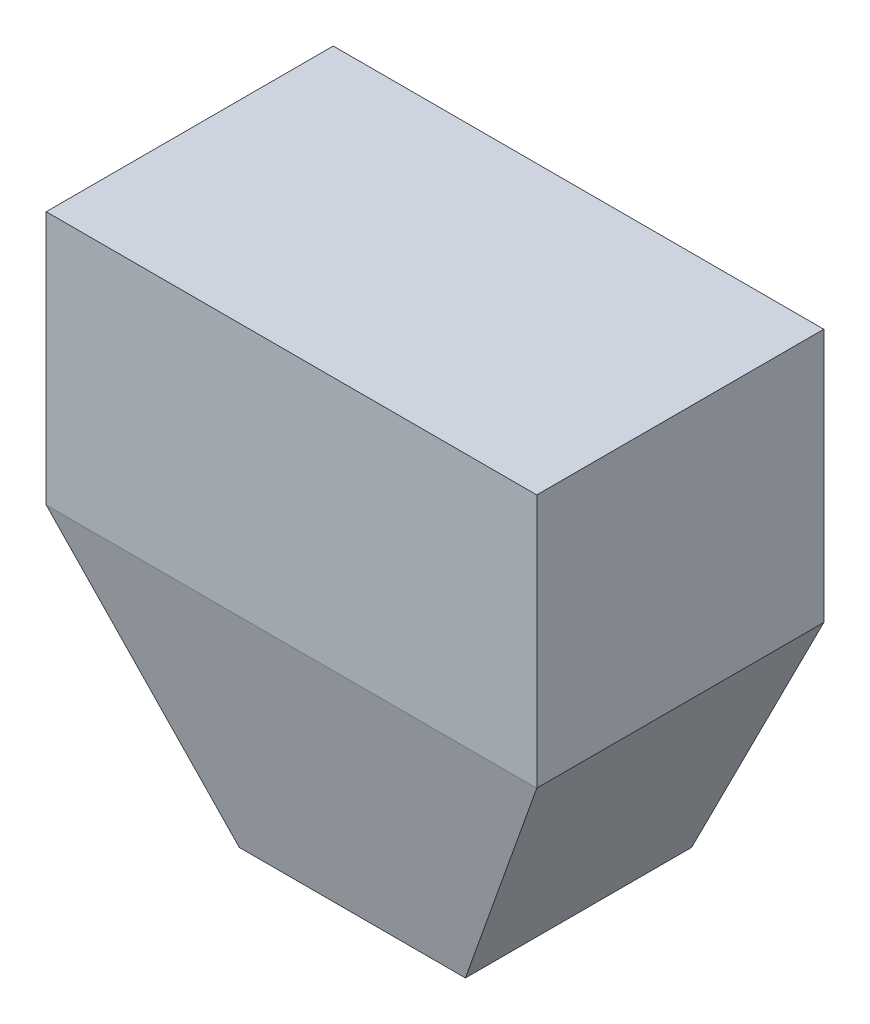
from build123d import *

# Parameters (mm, degrees)
SKETCH1_W           = 28.2
SKETCH1_H           = 29.2
BOSS_EXTRUDE1_DEPTH = 3
BOSS_EXTRUDE2_START = -3
SKETCH1_3_W         = 28.2
SKETCH1_3_H         = 29.2
BOSS_EXTRUDE2_DEPTH = 30
SKETCH3_3_W         = 20.4
SKETCH3_3_H         = 20.4
CUT_EXTRUDE1_DEPTH  = 30
CUT_EXTRUDE2_REACH  = 72.378
SKETCH4_R           = 2


with BuildPart() as part:
    # Sketch1 → Boss-Extrude1 (new body)
    with BuildSketch(Plane.XY):
        with Locations((-1, 0)):
            Rectangle(SKETCH1_W, SKETCH1_H)
    boss_extrude1 = extrude(amount=-BOSS_EXTRUDE1_DEPTH)

    # Sketch1<3> → Boss-Extrude2 (add)
    with BuildSketch(Plane.XY.offset(BOSS_EXTRUDE2_START)):
        with Locations((-1, 0)):
            Rectangle(SKETCH1_3_W, SKETCH1_3_H)
        with BuildLine():
            Line((-10.1, 2.9), (-10.1, 9))
            ThreePointArc((-10.1, 9), (-9.777817459, 9.777817459), (-9, 10.1))
            Line((-9, 10.1), (-2.9, 10.1))
            Line((-2.9, 10.1), (-2.9, 7.9))
            Line((-2.9, 7.9), (-4.9, 7.9))
            Line((-4.9, 7.9), (-4.9, 5.749))
            Line((-4.9, 5.749), (-2.7515, 3.6005))
            Line((-2.7515, 3.6005), (2.7515, 3.6005))
            Line((2.7515, 3.6005), (4.9, 5.749))
            Line((4.9, 5.749), (4.9, 7.9))
            Line((4.9, 7.9), (2.9, 7.9))
            Line((2.9, 7.9), (2.9, 10.1))
            Line((2.9, 10.1), (9, 10.1))
            ThreePointArc((9, 10.1), (9.777817459, 9.777817459), (10.1, 9))
            Line((10.1, 9), (10.1, 2.9))
            Line((10.1, 2.9), (7.9, 2.9))
            Line((7.9, 2.9), (7.9, 4.9))
            Line((7.9, 4.9), (5.749, 4.9))
            Line((5.749, 4.9), (3.6005, 2.7515))
            Line((3.6005, 2.7515), (3.6005, -2.7515))
            Line((3.6005, -2.7515), (5.749, -4.9))
            Line((5.749, -4.9), (7.9, -4.9))
            Line((7.9, -4.9), (7.9, -2.9))
            Line((7.9, -2.9), (10.1, -2.9))
            Line((10.1, -2.9), (10.1, -9))
            ThreePointArc((10.1, -9), (9.777817459, -9.777817459), (9, -10.1))
            Line((9, -10.1), (2.9, -10.1))
            Line((2.9, -10.1), (2.9, -7.9))
            Line((2.9, -7.9), (4.9, -7.9))
            Line((4.9, -7.9), (4.9, -5.749))
            Line((4.9, -5.749), (2.7515, -3.6005))
            Line((2.7515, -3.6005), (-2.7515, -3.6005))
            Line((-2.7515, -3.6005), (-4.9, -5.749))
            Line((-4.9, -5.749), (-4.9, -7.9))
            Line((-4.9, -7.9), (-2.9, -7.9))
            Line((-2.9, -7.9), (-2.9, -10.1))
            Line((-2.9, -10.1), (-9, -10.1))
            ThreePointArc((-9, -10.1), (-9.777817459, -9.777817459), (-10.1, -9))
            Line((-10.1, -9), (-10.1, -2.9))
            Line((-10.1, -2.9), (-7.9, -2.9))
            Line((-7.9, -2.9), (-7.9, -4.9))
            Line((-7.9, -4.9), (-5.749, -4.9))
            Line((-5.749, -4.9), (-3.6005, -2.7515))
            Line((-3.6005, -2.7515), (-3.6005, 2.7515))
            Line((-3.6005, 2.7515), (-5.749, 4.9))
            Line((-5.749, 4.9), (-7.9, 4.9))
            Line((-7.9, 4.9), (-7.9, 2.9))
            Line((-7.9, 2.9), (-10.1, 2.9))
        make_face(mode=Mode.SUBTRACT)
    boss_extrude2 = extrude(amount=-BOSS_EXTRUDE2_DEPTH)

    # Mirror1: Boss-Extrude1, Boss-Extrude2 across plane
    add(boss_extrude1.mirror(Plane(origin=(-15.1, 0, -3), x_dir=(0, 0, 1), z_dir=(-1, 0, 0))))
    add(boss_extrude2.mirror(Plane(origin=(-15.1, 0, -3), x_dir=(0, 0, 1), z_dir=(-1, 0, 0))))

    # Sketch3 → section 1 of loft1
    with BuildSketch(Plane(origin=(0, -44.6, 0), x_dir=(-1, 0, 0), z_dir=(0, -1, 0)), mode=Mode.PRIVATE) as loft1_s1:
        with BuildLine():
            Line((2.1, 7), (28.1, 7))
            Line((28.1, 7), (28.1, 33))
            Line((28.1, 33), (2.1, 33))
            Line((2.1, 33), (2.1, 7))
        make_face()
    # loft from a face of the part (loft1)
    loft([part.faces().sort_by_distance((-15.1, -14.6, -16.5))[0], loft1_s1.sketch])

    # Sketch3<3> → Cut-Extrude1 (cut)
    with BuildSketch(Plane(origin=(0, -44.6, 0), x_dir=(-1, 0, 0), z_dir=(0, -1, 0))):
        with Locations((15.1, 20)):
            Rectangle(SKETCH3_3_W, SKETCH3_3_H)
    extrude(amount=-CUT_EXTRUDE1_DEPTH, mode=Mode.SUBTRACT)

    # Sketch4 → Cut-Extrude2 (cut, up to next)
    with BuildSketch(Plane(origin=(0, 0, -33), x_dir=(-1, 0, 0), z_dir=(0, 0, -1)), mode=Mode.PRIVATE) as cut_extrude2_sk1:
        with Locations((15.1, -37.1)):
            Circle(SKETCH4_R)
    cut_extrude2_tool1 = extrude(cut_extrude2_sk1.sketch, amount=-CUT_EXTRUDE2_REACH, mode=Mode.PRIVATE) & part.part
    # Sketch4 → Cut-Extrude2 (cut, up to next)
    with BuildSketch(Plane(origin=(0, 0, -33), x_dir=(-1, 0, 0), z_dir=(0, 0, -1)), mode=Mode.PRIVATE) as cut_extrude2_sk2:
        with Locations((15.1, -22.1)):
            Circle(SKETCH4_R)
    cut_extrude2_tool2 = extrude(cut_extrude2_sk2.sketch, amount=-CUT_EXTRUDE2_REACH, mode=Mode.PRIVATE) & part.part
    add(cut_extrude2_tool1.solids().sort_by_distance((-15.1, -37.1, -33))[0], mode=Mode.SUBTRACT)
    add(cut_extrude2_tool2.solids().sort_by_distance((-15.1, -22.1, -33))[0], mode=Mode.SUBTRACT)


solid = part.part
